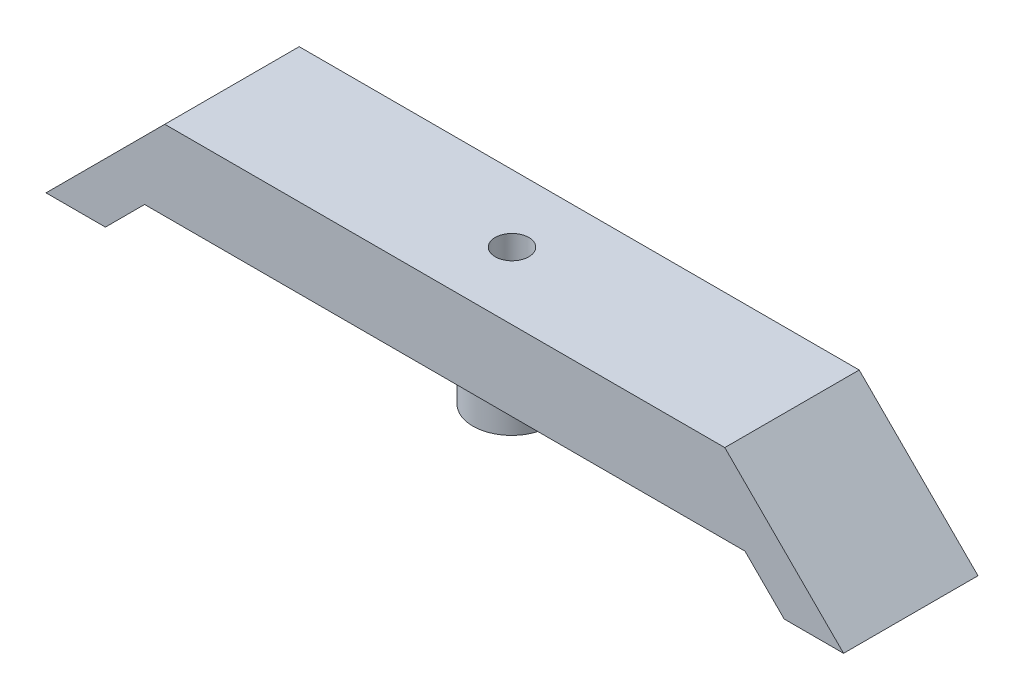
from build123d import *

# Parameters (mm, degrees)
Y_KSEKLIK_EKSTR_ZYON1_DEPTH = 12
KES_EKSTR_ZYON1_DEPTH       = 12
IZIM3_R                     = 3.451970481
Y_KSEKLIK_EKSTR_ZYON2_DEPTH = 5


with BuildPart() as part:
    # Çizim1 → Yükseklik-Ekstrüzyon1 (new body)
    with BuildSketch(Plane.XY):
        Polygon((0, 0), (-50, 0), (-60.606601718, -10.606601718), (-55.303300859, -10.606601718), (-51.802447925, -7.105748784), (1.802447925, -7.105748784), (5.303300859, -10.606601718), (10.606601718, -10.606601718), align=None)
    extrude(amount=Y_KSEKLIK_EKSTR_ZYON1_DEPTH)

    # Çizim2 → Kes-Ekstrüzyon1 (cut)
    with BuildSketch(Plane.XZ.offset(7.105748784)):
        with BuildLine():
            ThreePointArc((-23.536228909, 6.327680015), (-25, 7.5), (-26.463771091, 6.327680015))
            Line((-26.463771091, 6.327680015), (-25, 6))
            Line((-25, 6), (-23.536228909, 6.327680015))
        make_face()
        with BuildLine():
            Line((-25, 6), (-26.463771091, 6.327680015))
            ThreePointArc((-26.463771091, 6.327680015), (-26.5, 6), (-26.463771091, 5.672319985))
            Line((-26.463771091, 5.672319985), (-25, 6))
        make_face()
        with BuildLine():
            ThreePointArc((-23.5, 6), (-23.509084738, 6.16483835), (-23.536228909, 6.327680015))
            Line((-23.536228909, 6.327680015), (-25, 6))
            Line((-25, 6), (-23.536228909, 5.672319985))
            ThreePointArc((-23.536228909, 5.672319985), (-23.509084738, 5.83516165), (-23.5, 6))
        make_face()
        with BuildLine():
            Line((-25, 6), (-26.463771091, 5.672319985))
            ThreePointArc((-26.463771091, 5.672319985), (-25, 4.5), (-23.536228909, 5.672319985))
            Line((-23.536228909, 5.672319985), (-25, 6))
        make_face()
    extrude(amount=-KES_EKSTR_ZYON1_DEPTH, mode=Mode.SUBTRACT)

    # Çizim3 → Yükseklik-Ekstrüzyon2 (add)
    with BuildSketch(Plane.XZ.offset(7.105748784)):
        with Locations(Location((-25.000905718, 6.034003848, 0), (0, 0, 90))):
            Circle(IZIM3_R)
        with BuildLine():
            ThreePointArc((-23.572219211, 5.475380836), (-23.599693794, 5.409656229), (-23.630190025, 5.345277999))
            ThreePointArc((-23.630190025, 5.345277999), (-26.493538373, 6.387914237), (-23.46688981, 6.034003848))
            ThreePointArc((-23.46688981, 6.034003848), (-23.493452131, 5.74977069), (-23.572219211, 5.475380836))
        make_face(mode=Mode.SUBTRACT)
    extrude(amount=Y_KSEKLIK_EKSTR_ZYON2_DEPTH)


solid = part.part
